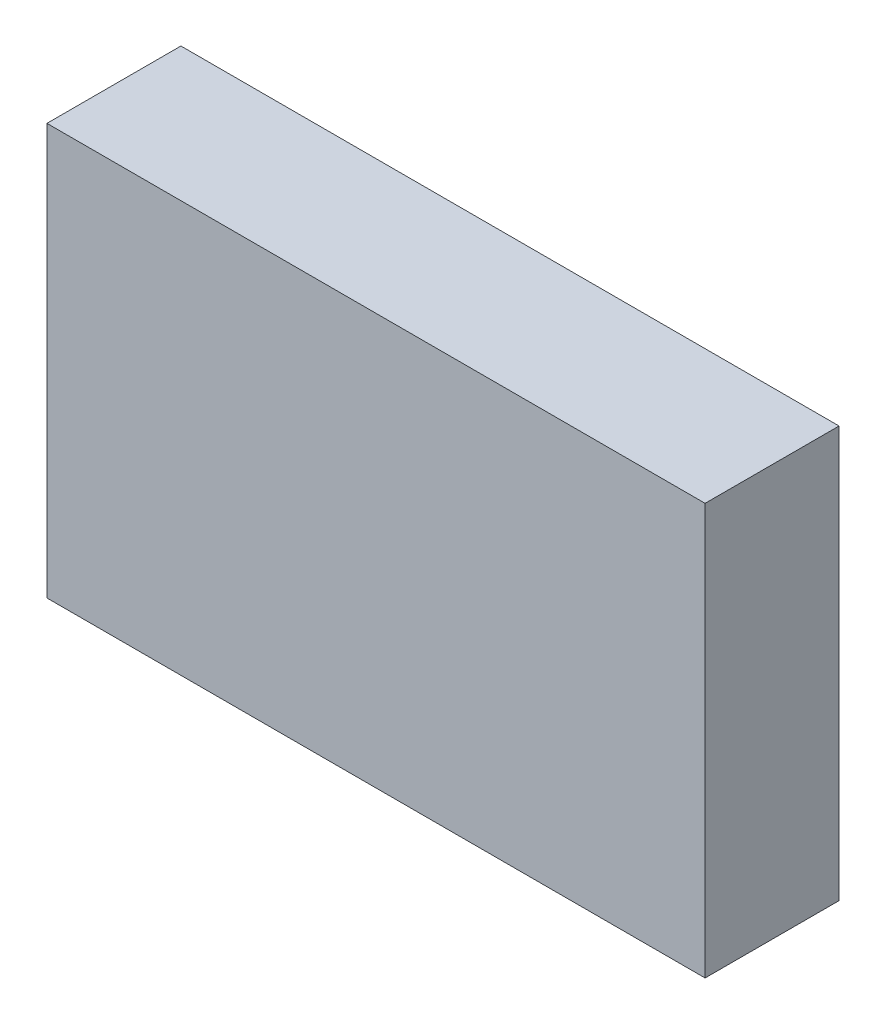
from build123d import *

# Parameters (mm, degrees)
SKETCH1_W      = 113.004025211
SKETCH1_H      = 70.58295581
EXTRUDE1_DEPTH = 23


with BuildPart() as part:
    # Sketch1 → Extrude1 (new body)
    with BuildSketch(Plane.XY):
        with Locations((-18.280752446, -6.149342469)):
            Rectangle(SKETCH1_W, SKETCH1_H)
    extrude(amount=EXTRUDE1_DEPTH)


solid = part.part
